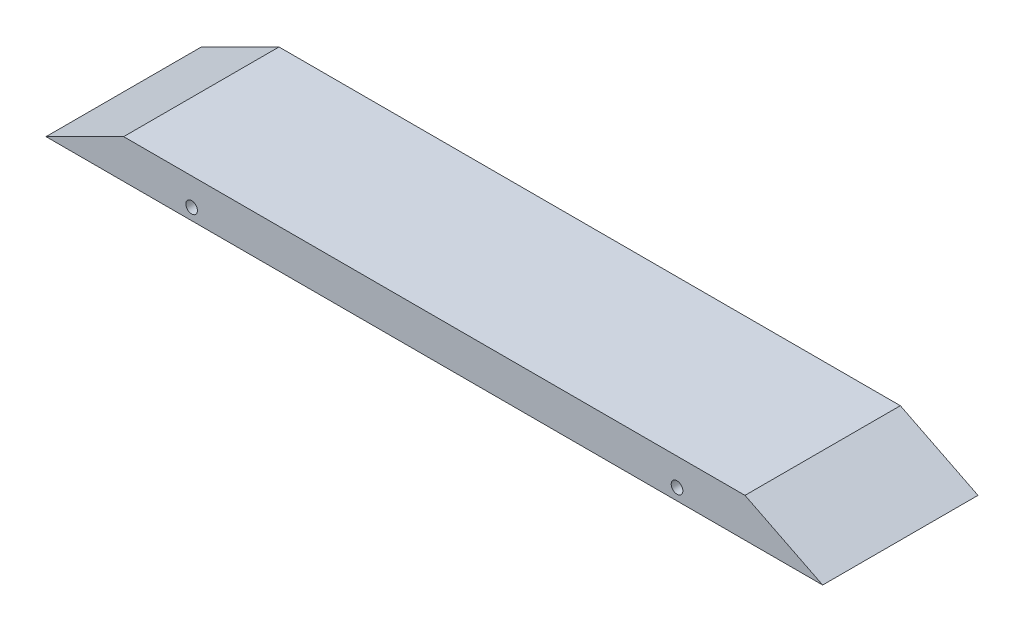
from build123d import *

# Parameters (mm, degrees)
EXTRUDE_1_DEPTH     = 40
SKETCH_2_R          = 1.5
CUT_EXTRUDE_1_DEPTH = 205.205778567


with BuildPart() as part:
    # 草图1 → 凸台-拉伸1 (new body)
    with BuildSketch(Plane.XY):
        Polygon((0, 0), (200, 0), (180, 10), (20, 10), align=None)
    extrude(amount=EXTRUDE_1_DEPTH)

    # 草图2 → 切除-拉伸1 (cut, through all)
    with BuildSketch(Plane.XY.offset(40)):
        with Locations((37.5, 3)):
            Circle(SKETCH_2_R)
        with Locations((162.5, 3)):
            Circle(SKETCH_2_R)
    extrude(amount=-CUT_EXTRUDE_1_DEPTH, mode=Mode.SUBTRACT)


solid = part.part
